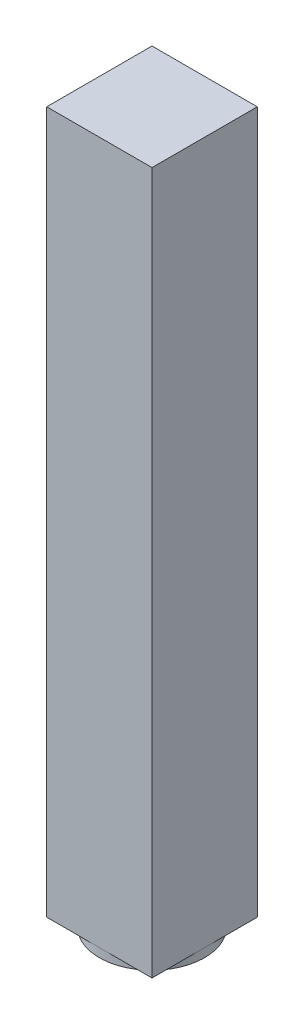
from build123d import *

# Parameters (mm, degrees)
SKETCH_1_W      = 60
SKETCH_1_H      = 60
EXTRUDE_1_DEPTH = 400
SKETCH_2_R      = 30
EXTRUDE_2_DEPTH = 5


with BuildPart() as part:
    # 草图1 → 凸台-拉伸1 (new body)
    with BuildSketch(Plane(origin=(0, 0, 0), x_dir=(1, 0, 0), z_dir=(0, 1, 0))):
        Rectangle(SKETCH_1_W, SKETCH_1_H)
    extrude(amount=EXTRUDE_1_DEPTH)

    # 草图2 → 凸台-拉伸2 (add)
    with BuildSketch(Plane.XZ):
        with Locations(Location((0, 0, 0), (0, 0, 270))):
            Circle(SKETCH_2_R)
    extrude(amount=EXTRUDE_2_DEPTH)


solid = part.part
